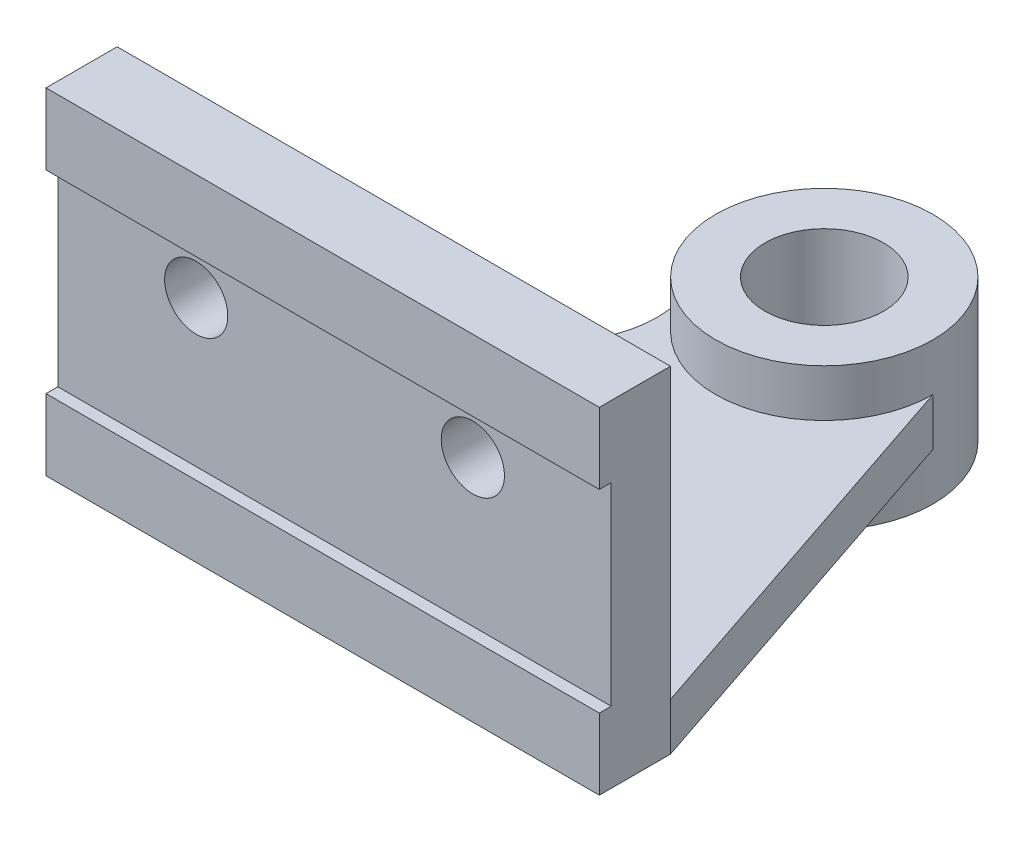
from build123d import *

# Parameters (mm, degrees)
SKETCH1_R           = 15
BOSS_EXTRUDE1_DEPTH = 18
BOSS_EXTRUDE2_DEPTH = 6
SKETCH1_4_R         = 9
BOSS_EXTRUDE3_DEPTH = 18
SKETCH2_R           = 20
SKETCH2_R_2         = 9
CUT_EXTRUDE1_DEPTH  = 12
SKETCH1_5_W         = 140
SKETCH1_5_H         = 18
BOSS_EXTRUDE4_DEPTH = 79
CUT_EXTRUDE2_REACH  = 171.486
SKETCH4_R           = 8
CUT_EXTRUDE3_REACH  = 201.412
SKETCH5_W           = 3
SKETCH5_H           = 49
SKETCH1_6_W         = 140
SKETCH1_6_H         = 18
BOSS_EXTRUDE5_DEPTH = 6


with BuildPart() as part:
    # Sketch1 → Boss-Extrude1 (new, symmetric)
    with BuildSketch(Plane(origin=(0, 0, 0), x_dir=(1, 0, 0), z_dir=(0, 1, 0))):
        with BuildLine():
            ThreePointArc((-25.82559397, -9.449269605), (4.798237479, -27.078163104), (27.5, 0))
            ThreePointArc((27.5, 0), (-4.798237479, 27.078163104), (-25.82559397, -9.449269605))
        make_face()
        Circle(SKETCH1_R, mode=Mode.SUBTRACT)
    extrude(amount=BOSS_EXTRUDE1_DEPTH, both=True)

    # Sketch1<3> → Boss-Extrude2 (add, symmetric)
    with BuildSketch(Plane(origin=(0, 0, 0), x_dir=(1, 0, 0), z_dir=(0, 1, 0))):
        with BuildLine():
            Line((-78.919837001, -62), (-78.919837001, -100))
            Line((-78.919837001, -100), (61.080162999, -100))
            Line((61.080162999, -100), (27.5, 0))
            ThreePointArc((27.5, 0), (4.798237479, -27.078163104), (-25.82559397, -9.449269605))
            ThreePointArc((-25.82559397, -9.449269605), (-30.4703787, -34.480836347), (-54.645867965, -42.462006534))
            ThreePointArc((-54.645867965, -42.462006534), (-43.339731406, -49.45965273), (-38.919837001, -62))
            ThreePointArc((-38.919837001, -62), (-58.919837001, -82), (-78.919837001, -62))
        make_face()
    extrude(amount=BOSS_EXTRUDE2_DEPTH, both=True)

    # Sketch1<4> → Boss-Extrude3 (add, symmetric)
    with BuildSketch(Plane(origin=(0, 0, 0), x_dir=(1, 0, 0), z_dir=(0, 1, 0))):
        with BuildLine():
            ThreePointArc((-54.645867965, -42.462006534), (-71.460184271, -46.419894405), (-78.919837001, -62))
            ThreePointArc((-78.919837001, -62), (-58.919837001, -82), (-38.919837001, -62))
            ThreePointArc((-38.919837001, -62), (-43.339731406, -49.45965273), (-54.645867965, -42.462006534))
        make_face()
        with Locations((-58.919837001, -62)):
            Circle(SKETCH1_4_R, mode=Mode.SUBTRACT)
    extrude(amount=BOSS_EXTRUDE3_DEPTH, both=True)

    # Sketch2 → Cut-Extrude1 (cut)
    with BuildSketch(Plane.XZ.offset(18)):
        with Locations((-58.919837001, 62)):
            Circle(SKETCH2_R)
        with Locations((-58.919837001, 62)):
            Circle(SKETCH2_R_2, mode=Mode.SUBTRACT)
    extrude(amount=-CUT_EXTRUDE1_DEPTH, mode=Mode.SUBTRACT)

    # Sketch1<5> → Boss-Extrude4 (add)
    with BuildSketch(Plane(origin=(0, 0, 0), x_dir=(1, 0, 0), z_dir=(0, 1, 0))):
        with Locations((-8.919837001, -109)):
            Rectangle(SKETCH1_5_W, SKETCH1_5_H)
    extrude(amount=BOSS_EXTRUDE4_DEPTH)

    # Sketch4 → Cut-Extrude2 (cut, up to next)
    with BuildSketch(Plane(origin=(0, 0, 100), x_dir=(-1, 0, 0), z_dir=(0, 0, -1)), mode=Mode.PRIVATE) as cut_extrude2_sk1:
        with Locations((-26.080162999, 49)):
            Circle(SKETCH4_R)
    cut_extrude2_tool1 = extrude(cut_extrude2_sk1.sketch, amount=-CUT_EXTRUDE2_REACH, mode=Mode.PRIVATE) & part.part
    # Sketch4 → Cut-Extrude2 (cut, up to next)
    with BuildSketch(Plane(origin=(0, 0, 100), x_dir=(-1, 0, 0), z_dir=(0, 0, -1)), mode=Mode.PRIVATE) as cut_extrude2_sk2:
        with Locations((43.919837001, 49)):
            Circle(SKETCH4_R)
    cut_extrude2_tool2 = extrude(cut_extrude2_sk2.sketch, amount=-CUT_EXTRUDE2_REACH, mode=Mode.PRIVATE) & part.part
    add(cut_extrude2_tool1.solids().sort_by_distance((26.080163, 49, 100))[0], mode=Mode.SUBTRACT)
    add(cut_extrude2_tool2.solids().sort_by_distance((-43.919837, 49, 100))[0], mode=Mode.SUBTRACT)

    # Sketch5 → Cut-Extrude3 (cut, up to next)
    with BuildSketch(Plane.ZY.offset(78.919837001), mode=Mode.PRIVATE) as cut_extrude3_sk1:
        with Locations((116.5, 36.5)):
            Rectangle(SKETCH5_W, SKETCH5_H)
    cut_extrude3_tool1 = extrude(cut_extrude3_sk1.sketch, amount=-CUT_EXTRUDE3_REACH, mode=Mode.PRIVATE) & part.part
    add(cut_extrude3_tool1.solids().sort_by_distance((-78.919837, 36.5, 116.5))[0], mode=Mode.SUBTRACT)

    # Sketch1<6> → Boss-Extrude5 (add)
    with BuildSketch(Plane(origin=(0, 0, 0), x_dir=(1, 0, 0), z_dir=(0, 1, 0))):
        with Locations((-8.919837001, -109)):
            Rectangle(SKETCH1_6_W, SKETCH1_6_H)
    extrude(amount=-BOSS_EXTRUDE5_DEPTH)


solid = part.part
